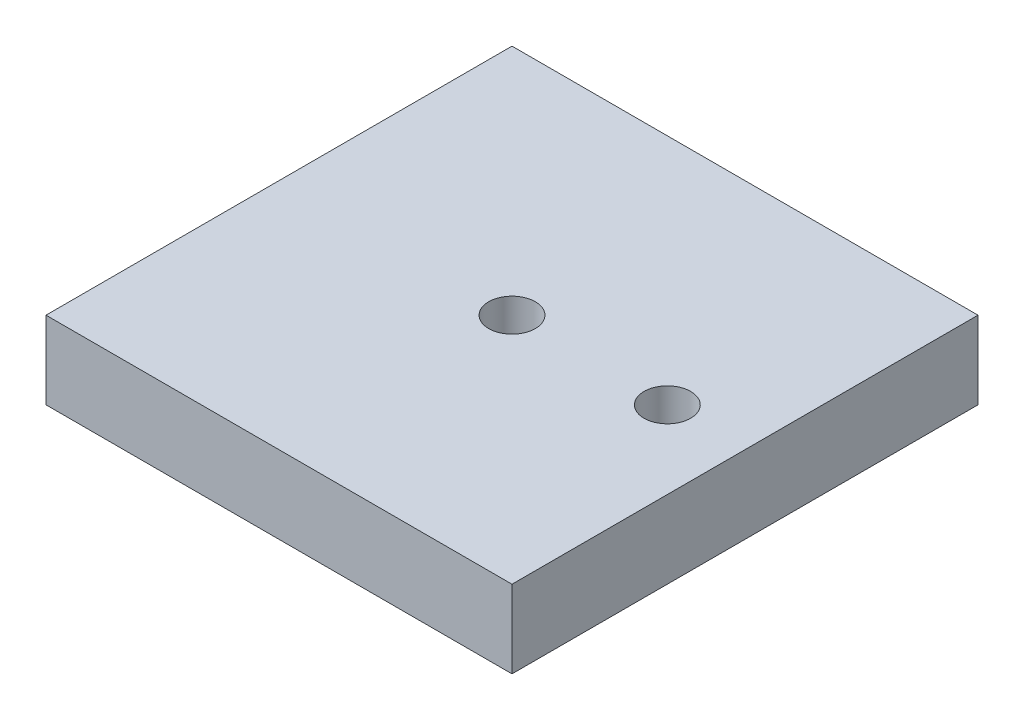
from build123d import *

# Parameters (mm, degrees)
SKETCH2_W           = 60
SKETCH2_H           = 60
BOSS_EXTRUDE1_DEPTH = 10
SKETCH3_R           = 3
CUT_EXTRUDE1_DEPTH  = 44.588989435


with BuildPart() as part:
    # Sketch2 → Boss-Extrude1 (new body)
    with BuildSketch(Plane(origin=(0, 0, 0), x_dir=(1, 0, 0), z_dir=(0, 1, 0))):
        Rectangle(SKETCH2_W, SKETCH2_H)
    extrude(amount=BOSS_EXTRUDE1_DEPTH)

    # Sketch3 → Cut-Extrude1 (cut, through all)
    with BuildSketch(Plane(origin=(0, 10, 0), x_dir=(1, 0, 0), z_dir=(0, 1, 0))):
        with Locations(Location((20, 0, 0), (0, 0, 270))):
            Circle(SKETCH3_R)
        with Locations(Location((0, 0, 0), (0, 0, 270))):
            Circle(SKETCH3_R)
    extrude(amount=-CUT_EXTRUDE1_DEPTH, mode=Mode.SUBTRACT)


solid = part.part
